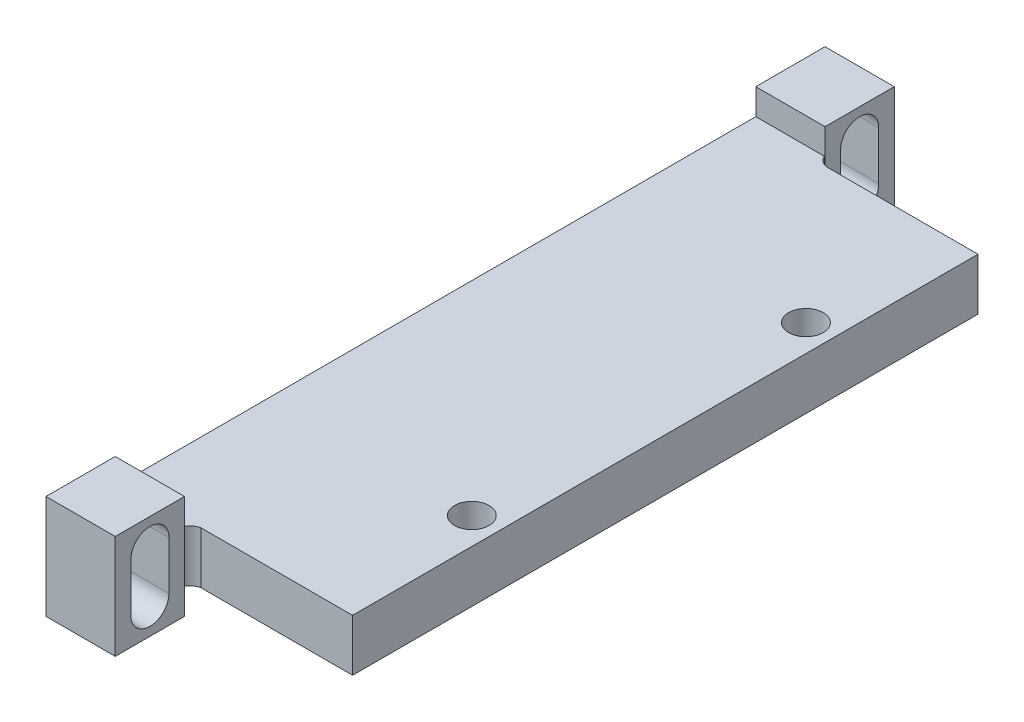
from build123d import *

# Parameters (mm, degrees)
BOSS_EXTRU_1_DEPTH        = 3
BOSS_EXTRU_1_DEPTH_BACK   = 3
ESQUISSE1_W               = 4
ESQUISSE1_H               = 4
BOSS_EXTRU_1_2_DEPTH      = 3
BOSS_EXTRU_1_2_DEPTH_BACK = 3
BOSS_EXTRU_2_DEPTH        = 1.5
BOSS_EXTRU_2_DEPTH_BACK   = 1.5
ESQUISSE4_R               = 1
ENL_V_MAT_EXTRU_1_DEPTH   = 21.5
ENL_V_MAT_EXTRU_2_DEPTH   = 21.5


with BuildPart() as part:
    # Esquisse1 → Boss.-Extru.1 (new, two sides: drawn at the far end of the back side and taken through both)
    with BuildSketch(Plane(origin=(0, 0, 0), x_dir=(1, 0, 0), z_dir=(0, 1, 0)).offset(-BOSS_EXTRU_1_DEPTH_BACK)):
        with Locations((0, 20.5)):
            Rectangle(ESQUISSE1_W, ESQUISSE1_H)
    extrude(amount=BOSS_EXTRU_1_DEPTH + BOSS_EXTRU_1_DEPTH_BACK)



with BuildPart() as body_2:
    # Esquisse1 → Boss.-Extru.1 2 (new, two sides: drawn at the far end of the back side and taken through both)
    with BuildSketch(Plane(origin=(0, 0, 0), x_dir=(1, 0, 0), z_dir=(0, 1, 0)).offset(-BOSS_EXTRU_1_2_DEPTH_BACK)):
        with Locations((0, -20.5)):
            Rectangle(ESQUISSE1_W, ESQUISSE1_H)
    extrude(amount=BOSS_EXTRU_1_2_DEPTH + BOSS_EXTRU_1_2_DEPTH_BACK)


with BuildPart() as part_1:
    add(part.part)

    add(body_2.part)  # Boss.-Extru.2 merges body 2
    # Esquisse3 → Boss.-Extru.2 (add, two sides: drawn at the far end of the back side and taken through both)
    with BuildSketch(Plane(origin=(0, 0, 0), x_dir=(1, 0, 0), z_dir=(0, 1, 0)).offset(-BOSS_EXTRU_2_DEPTH_BACK)):
        with BuildLine():
            Line((-2, 18.571568884), (1.93, 18.571568884))
            add(Edge.make_bspline(
                [(1.93, 18.571568884), (2.088145302, 18.144214449), (2.536201665, 18.035775419)],
                knots=[0, 0, 0, 1, 1, 1], degree=2))
            Line((2.536201665, 18.035775419), (11.300625785, 18.035775419))
            Line((11.300625785, 18.035775419), (11.300625785, -18.091491534))
            Line((11.300625785, -18.091491534), (2.536201665, -18.091491534))
            add(Edge.make_bspline(
                [(2.536201665, -18.091491534), (2.088145302, -18.199930564), (1.93, -18.627284999)],
                knots=[0, 0, 0, 1, 1, 1], degree=2))
            Line((1.93, -18.627284999), (-2, -18.627284999))
            Line((-2, -18.627284999), (-2, 18.571568884))
        make_face()
    extrude(amount=BOSS_EXTRU_2_DEPTH + BOSS_EXTRU_2_DEPTH_BACK)

    # Esquisse4 → Enlèv. mat.-Extru.1 (cut)
    with BuildSketch(Plane(origin=(0, 1.5, 0), x_dir=(1, 0, 0), z_dir=(0, 1, 0))):
        with Locations((9.75, 9.645867946)):
            Circle(ESQUISSE4_R)
        with Locations((9.75, -9.654132054)):
            Circle(ESQUISSE4_R)
    extrude(amount=-ENL_V_MAT_EXTRU_1_DEPTH, mode=Mode.SUBTRACT)

    # Esquisse5 → Enlèv. mat.-Extru.2 (cut)
    with BuildSketch(Plane(origin=(2, 0, 0), x_dir=(0, 0, -1), z_dir=(1, 0, 0))):
        with BuildLine():
            Line((-19.4, 1.4), (-19.4, -1.4))
            ThreePointArc((-19.4, -1.4), (-20.5, -2.5), (-21.6, -1.4))
            Line((-21.6, -1.4), (-21.6, 1.4))
            ThreePointArc((-21.6, 1.4), (-20.5, 2.5), (-19.4, 1.4))
        make_face()
        with BuildLine():
            Line((19.4, 1.4), (19.4, -1.4))
            ThreePointArc((19.4, -1.4), (20.5, -2.5), (21.6, -1.4))
            Line((21.6, -1.4), (21.6, 1.4))
            ThreePointArc((21.6, 1.4), (20.5, 2.5), (19.4, 1.4))
        make_face()
    extrude(amount=-ENL_V_MAT_EXTRU_2_DEPTH, mode=Mode.SUBTRACT)


solid = part_1.part
